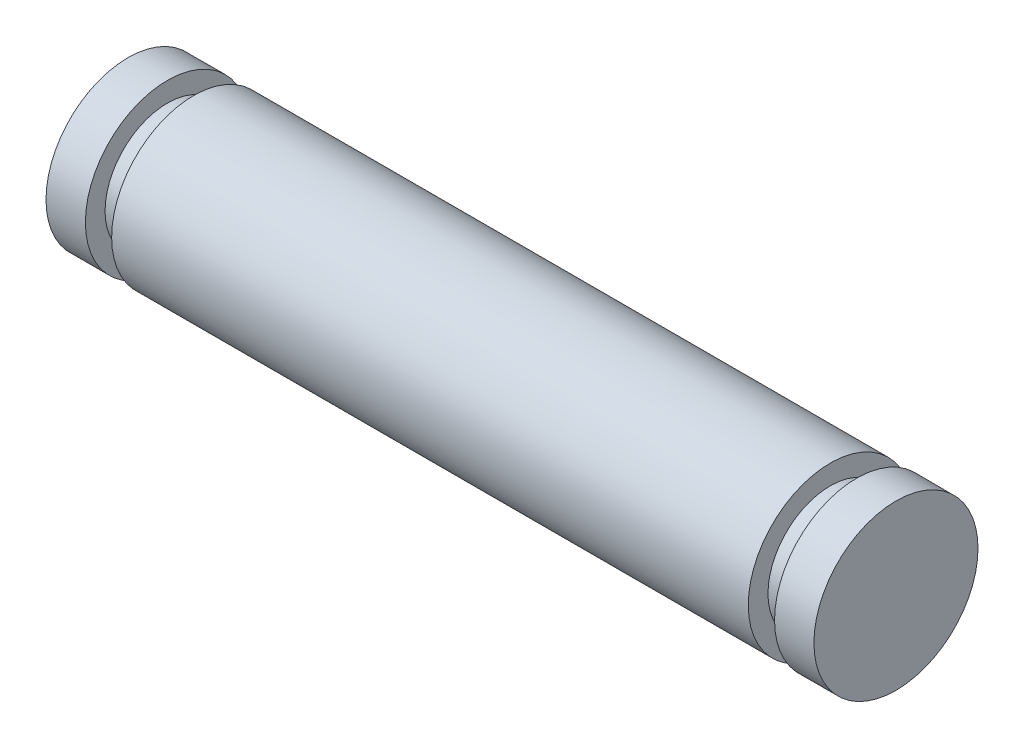
from build123d import *

# Parameters (mm, degrees)
SKETCH1_R      = 1.5875
EXTRUDE1_DEPTH = 7.4295
SKETCH2_W      = 0.508
SKETCH2_H      = 0.381


with BuildPart() as part:
    # Sketch1 → Extrude1 (new, symmetric)
    with BuildSketch(Plane(origin=(0, 0, 0), x_dir=(0, 0, -1), z_dir=(1, 0, 0))):
        Circle(SKETCH1_R)
    extrude(amount=EXTRUDE1_DEPTH, both=True)

    # Sketch2 → Cut-Revolve1 (revolve, cut)
    with BuildSketch(Plane.XY):
        with Locations((-6.4135, 1.397)):
            Rectangle(SKETCH2_W, SKETCH2_H)
        with Locations((6.4135, 1.397)):
            Rectangle(SKETCH2_W, SKETCH2_H)
    revolve(axis=Axis((-7.4295, 0, 0), (1, 0, 0)), mode=Mode.SUBTRACT)


solid = part.part
